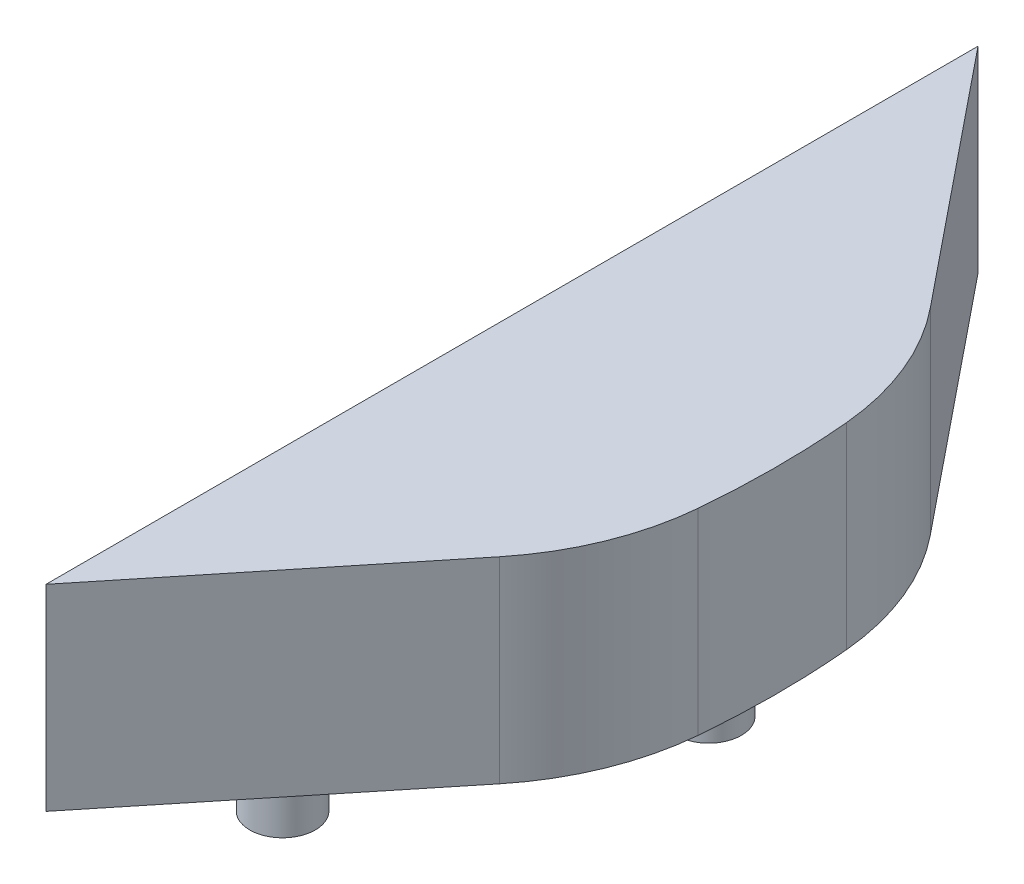
from build123d import *

# Parameters (mm, degrees)
BOSS_EXTRUDE2_DEPTH = 38.1
SKETCH4_R           = 6.35
BOSS_EXTRUDE3_DEPTH = 10.16
CUT_EXTRUDE1_DEPTH  = 72.136
FILLET1_R           = 50.8


with BuildPart() as part:
    # Sketch3 → Boss-Extrude2 (new body)
    with BuildSketch(Plane(origin=(0, 0, 0), x_dir=(1, 0, 0), z_dir=(0, 1, 0))):
        with BuildLine():
            Line((0, 90.272622301), (0, -90.272622301))
            add(Edge.make_bspline(
                [(0, -90.272622301), (51.063722035, -90.272622301), (51.063722035, 0), (51.063722035, 90.272622301), (0, 90.272622301)],
                knots=[3.141592654, 3.141592654, 3.141592654, 4.71238898, 4.71238898, 6.283185307, 6.283185307, 6.283185307], degree=2, weights=[1, 0.707106781, 1, 0.707106781, 1]))
        make_face()
    extrude(amount=BOSS_EXTRUDE2_DEPTH)

    # Sketch4 → Boss-Extrude3 (add)
    with BuildSketch(Plane(origin=(0, 0, 0), x_dir=(-1, 0, 0), z_dir=(0, -1, 0))):
        with Locations(Location((-12.7, -57.15, 0), (0, 0, 270))):
            Circle(SKETCH4_R)
        with Locations(Location((-12.7, 57.15, 0), (0, 0, 270))):
            Circle(SKETCH4_R)
        with Locations(Location((-38.1, 0, 0), (0, 0, 270))):
            Circle(SKETCH4_R)
    extrude(amount=BOSS_EXTRUDE3_DEPTH)

    # Sketch5 → Cut-Extrude1 (cut)
    with BuildSketch(Plane(origin=(0, 0, 0), x_dir=(-1, 0, 0), z_dir=(0, -1, 0))):
        Polygon((0, -90.272622301), (-47.948224184, -31.049250245), (-73.055798017, -65.580157533), (-28.861670947, -122.242067224), align=None)
        Polygon((0, 90.272622301), (-47.948224184, 31.049250245), (-64.283944167, 60.660936273), (-1.502105519, 110.713212963), align=None)
    extrude(amount=-CUT_EXTRUDE1_DEPTH, mode=Mode.SUBTRACT)

    # Fillet1
    fillet1_edges = [part.edges().sort_by_distance(p)[0] for p in [
        (47.948224184, 19.05, -31.049250245),
        (47.948224184, 19.05, 31.049250245),
    ]]
    fillet(fillet1_edges, radius=FILLET1_R)


solid = part.part
